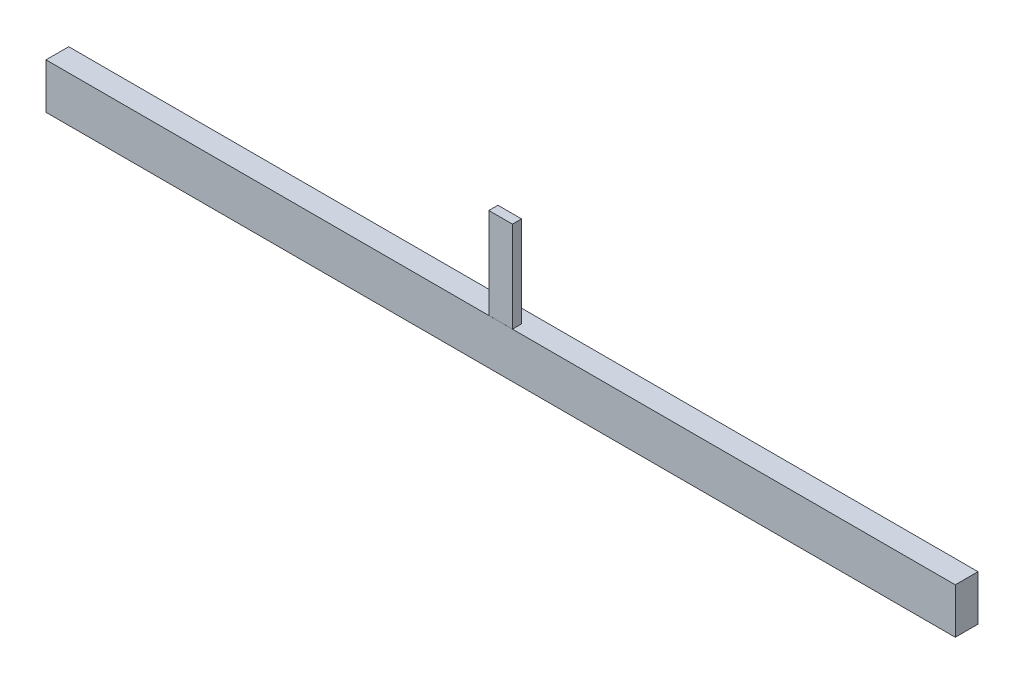
from build123d import *

# Parameters (mm, degrees)
SKETCH1_W                = 0.52
SKETCH1_H                = 2
BOSS_EXTRUDE1_DEPTH      = 0.2
BOSS_EXTRUDE2_DEPTH      = 0.2
BOSS_EXTRUDE2_DEPTH_BACK = 0.3
SKETCH2_W                = 36
SKETCH2_H                = 1
SKETCH3_R                = 2
BOSS_EXTRUDE3_DEPTH      = 10
CUT_EXTRUDE1_DEPTH       = 23.1719236
CUT_EXTRUDE1_DEPTH_BACK  = 23.1719236
SKETCH6_W                = 11.789249308
SKETCH6_H                = 12.137764095
CUT_EXTRUDE4_DEPTH       = 37


with BuildPart() as part:
    # Sketch1 → Boss-Extrude1 (new body)
    with BuildSketch(Plane.XY):
        Rectangle(SKETCH1_W, SKETCH1_H)
    extrude(amount=BOSS_EXTRUDE1_DEPTH)


with BuildPart() as body_2:
    # Sketch2 → Boss-Extrude2 (new, two sides: drawn at the far end of the back side and taken through both)
    with BuildSketch(Plane.XY.offset(-BOSS_EXTRUDE2_DEPTH_BACK)):
        with Locations((0.0074775, -1.500340687)):
            Rectangle(SKETCH2_W, SKETCH2_H)
    extrude(amount=BOSS_EXTRUDE2_DEPTH + BOSS_EXTRUDE2_DEPTH_BACK)

    # Sketch3 → Boss-Extrude3 (add)
    with BuildSketch(Plane(origin=(0, -1.000340687, 0), x_dir=(1, 0, 0), z_dir=(0, 1, 0))):
        with Locations((-16.989068611, 1.047708682)):
            Circle(SKETCH3_R)
        with Locations((17.0074775, 1.05)):
            Circle(SKETCH3_R)
    extrude(amount=-BOSS_EXTRUDE3_DEPTH)

    # Sketch4 → Cut-Extrude1 (cut, two sides: drawn at the far end of the back side and taken through both)
    with BuildSketch(Plane(origin=(0, 0, 0), x_dir=(1, 0, 0), z_dir=(0, 1, 0)).offset(-CUT_EXTRUDE1_DEPTH_BACK)):
        Polygon((-10, -70.730973246), (-10, -1.883069964), (-10, 3.894246396), (-10, 72.742149678), (-147.695806565, 72.742149678), (-147.695806565, -70.730973246), align=None)
    extrude(amount=CUT_EXTRUDE1_DEPTH + CUT_EXTRUDE1_DEPTH_BACK, mode=Mode.SUBTRACT)

    # Sketch6 → Cut-Extrude4 (cut)
    with BuildSketch(Plane(origin=(0, 0, 0), x_dir=(1, 0, 0), z_dir=(0, 1, 0))):
        with Locations((15.894624654, 2.041049977)):
            Rectangle(SKETCH6_W, SKETCH6_H)
    extrude(amount=-CUT_EXTRUDE4_DEPTH, mode=Mode.SUBTRACT)


solid = Compound([part.part, body_2.part])
